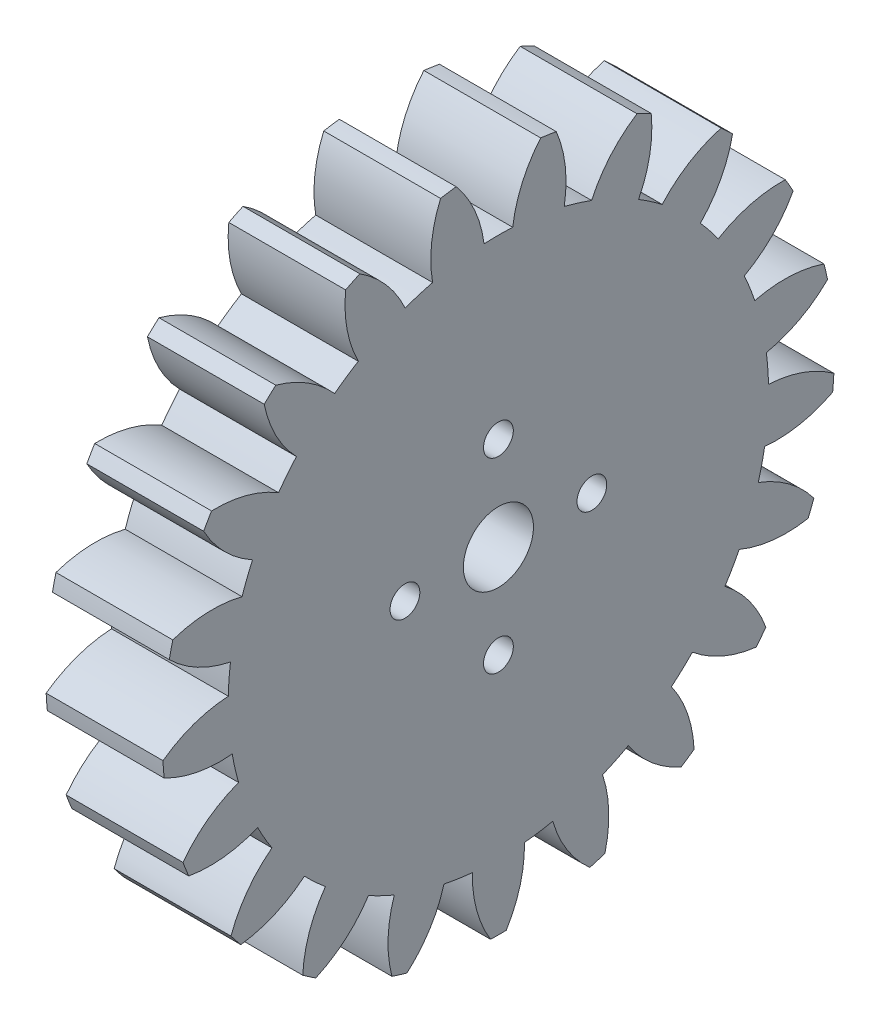
from build123d import *

# Parameters (mm, degrees)
BASPROSKE_W              = 15
BASPROSKE_H              = 28.75
TOOTHCUT_DEPTH           = 44.337339558
TEETHCUTS_COUNT          = 21
TEETHCUTS_ANGLE          = 342.857142857
HUBNEAONESKE_R           = 12
HUBNEARONE_DEPTH         = 35.0000508
BORSKE_R                 = 3
BORE_DEPTH               = 15.0000508
CUT_EXTRUDE_1_DEPTH      = 54.627906094
CUT_EXTRUDE_1_DEPTH_BACK = 54.627906094
SKETCH_2_R               = 1.275
CUT_EXTRUDE_2_DEPTH      = 44.312224095
CUT_EXTRUDE_3_DEPTH      = 5


with BuildPart() as part:
    # BasProSke → Base-Revolve (revolve)
    with BuildSketch(Plane(origin=(0, 0, 0), x_dir=(1, 0, 0), z_dir=(0, 1, 0)), mode=Mode.PRIVATE) as base_revolve_sk:
        with Locations((7.5, 14.375)):
            Rectangle(BASPROSKE_W, BASPROSKE_H)
    revolve(base_revolve_sk.sketch.rotate(Axis((-10, 0, 0), (1, 0, 0)), 180), axis=Axis((-10, 0, 0), (1, 0, 0)))

    # TooCutSke → ToothCut (cut, through all)
    with BuildSketch(Plane(origin=(0, 0, 0), x_dir=(0, 0, -1), z_dir=(1, 0, 0))):
        with BuildLine():
            ThreePointArc((1.226021101, 23.091475662), (0, 23.124), (-1.226021101, 23.091475662))
            ThreePointArc((-1.226021101, 23.091475662), (-2.035978165, 25.992768242), (-3.636318743, 28.544716344))
            ThreePointArc((-3.636318743, 28.544716344), (0, 28.7754), (3.636318743, 28.544716344))
            ThreePointArc((3.636318743, 28.544716344), (2.035978165, 25.992768242), (1.226021101, 23.091475662))
        make_face()
    toothcut = extrude(amount=TOOTHCUT_DEPTH, mode=Mode.SUBTRACT)

    # TeethCuts: ToothCut ×21 about axis
    teethcuts_axis = Axis((-10, 0, 0), (1, 0, 0))
    for i in range(1, TEETHCUTS_COUNT):
        add(toothcut.rotate(teethcuts_axis, i * TEETHCUTS_ANGLE / (TEETHCUTS_COUNT - 1)), mode=Mode.SUBTRACT)

    # HubNeaOneSke → HubNearOne (add)
    with BuildSketch(Plane.ZY):
        with Locations(Location((0, 0, 0), (0, 0, 180))):
            Circle(HUBNEAONESKE_R)
    extrude(amount=HUBNEARONE_DEPTH)

    # BorSke → Bore (cut, symmetric)
    with BuildSketch(Plane(origin=(0, 0, 0), x_dir=(0, 0, -1), z_dir=(1, 0, 0))):
        with Locations(Location((0, 0, 0), (0, 0, 180))):
            Circle(BORSKE_R)
    extrude(amount=BORE_DEPTH, both=True, mode=Mode.SUBTRACT)

    # 草圖1 → 除料-伸長1 (cut, two sides: drawn at the far end of the back side and taken through both)
    with BuildSketch(Plane(origin=(0, 0, 0), x_dir=(1, 0, 0), z_dir=(0, 1, 0)).offset(-CUT_EXTRUDE_1_DEPTH_BACK)):
        Polygon((-35.0000508, -11.862952099), (-35.0000508, -15.448809423), (0, -15.448809423), (0, -11.862952099), (0, 12), (-35.0000508, 12), align=None)
    extrude(amount=CUT_EXTRUDE_1_DEPTH + CUT_EXTRUDE_1_DEPTH_BACK, mode=Mode.SUBTRACT)

    # 草圖2 → 除料-伸長2 (cut, through all)
    with BuildSketch(Plane.ZY):
        with Locations((0, 8)):
            Circle(SKETCH_2_R)
        with Locations((8, 0)):
            Circle(SKETCH_2_R)
        with Locations((0, -8)):
            Circle(SKETCH_2_R)
        with Locations((-8, 0)):
            Circle(SKETCH_2_R)
    extrude(amount=-CUT_EXTRUDE_2_DEPTH, mode=Mode.SUBTRACT)

    # 草圖3 → 除料-伸長3 (cut)
    with BuildSketch(Plane.ZY):
        with BuildLine():
            ThreePointArc((15.633632839, -24.127826762), (16.195451669, -23.754364762), (16.748353108, -23.367823351))
            ThreePointArc((16.748353108, -23.367823351), (16.182150595, -20.424548747), (14.807455158, -17.761155586))
            ThreePointArc((14.807455158, -17.761155586), (15.728314388, -16.951091484), (16.604929283, -16.093343329))
            ThreePointArc((16.604929283, -16.093343329), (19.158143938, -17.66323046), (22.050876182, -18.447800942))
            ThreePointArc((22.050876182, -18.447800942), (22.477655121, -17.925331803), (22.892057619, -17.392992783))
            ThreePointArc((22.892057619, -17.392992783), (21.483464476, -14.747370732), (19.384793984, -12.60750325))
            ThreePointArc((19.384793984, -12.60750325), (20.025971437, -11.562), (20.610815085, -10.483972412))
            ThreePointArc((20.610815085, -10.483972412), (23.513329931, -11.231540632), (26.508802408, -11.128607052))
            ThreePointArc((26.508802408, -11.128607052), (26.762620274, -10.503554451), (27.001702351, -9.872718478))
            ThreePointArc((27.001702351, -9.872718478), (24.87587826, -7.75982411), (22.239708796, -6.333618923))
            ThreePointArc((22.239708796, -6.333618923), (22.544233041, -5.145574077), (22.785339517, -3.943054539))
            ThreePointArc((22.785339517, -3.943054539), (25.779253374, -3.80187913), (28.611305207, -2.820587588))
            ThreePointArc((28.611305207, -2.820587588), (28.669609169, -2.148490191), (28.712127333, -1.475209811))
            ThreePointArc((28.712127333, -1.475209811), (26.057961094, -0.082783062), (23.118527885, 0.50303524))
            ThreePointArc((23.118527885, 0.50303524), (23.059340606, 1.728058684), (22.935286541, 2.948221034))
            ThreePointArc((22.935286541, 2.948221034), (25.754577023, 3.965596017), (28.17156798, 5.738053461))
            ThreePointArc((28.17156798, 5.738053461), (28.029177475, 6.397476851), (27.871353801, 7.053377721))
            ThreePointArc((27.871353801, 7.053377721), (24.924679732, 7.601613624), (21.943164316, 7.294992515))
            ThreePointArc((21.943164316, 7.294992515), (21.525524564, 8.448145847), (21.047332707, 9.57753423))
            ThreePointArc((21.047332707, 9.57753423), (23.441493482, 11.380710555), (25.22866331, 13.786843279))
            ThreePointArc((25.22866331, 13.786843279), (24.898230359, 14.375), (24.554088173, 14.95524169))
            ThreePointArc((24.554088173, 14.95524169), (21.576731195, 14.610573581), (18.818054303, 13.438757691))
            ThreePointArc((18.818054303, 13.438757691), (18.079071201, 14.417578178), (17.289230996, 15.35584148))
            ThreePointArc((17.289230996, 15.35584148), (19.045530374, 17.784599017), (20.04408119, 20.610611569))
            ThreePointArc((20.04408119, 20.610611569), (19.554966211, 21.075241315), (19.055084056, 21.528266805))
            ThreePointArc((19.055084056, 21.528266805), (16.311595404, 20.321319958), (14.020877582, 18.388430271))
            ThreePointArc((14.020877582, 18.388430271), (13.026213023, 19.105945417), (11.994905239, 19.769714826))
            ThreePointArc((11.994905239, 19.769714826), (12.957288312, 22.608247809), (13.078494494, 25.603036573))
            ThreePointArc((13.078494494, 25.603036573), (12.4741575, 25.902854952), (11.862952099, 26.188410939))
            ThreePointArc((11.862952099, 26.188410939), (9.597102778, 24.226427877), (7.977884359, 21.704210125))
            ThreePointArc((7.977884359, 21.704210125), (6.815918653, 22.096665561), (5.634779513, 22.426962252))
            ThreePointArc((5.634779513, 22.426962252), (5.717734322, 25.42305457), (4.950826169, 28.320519421))
            ThreePointArc((4.950826169, 28.320519421), (4.284965153, 28.428886254), (3.616744788, 28.521599835))
            ThreePointArc((3.616744788, 28.521599835), (2.029865455, 25.978911364), (1.226021101, 23.091475662))
            ThreePointArc((1.226021101, 23.091475662), (0, 23.124), (-1.226021101, 23.091475662))
            ThreePointArc((-1.226021101, 23.091475662), (-2.029865455, 25.978911364), (-3.616744788, 28.521599835))
            ThreePointArc((-3.616744788, 28.521599835), (-4.284965153, 28.428886254), (-4.950826169, 28.320519421))
            ThreePointArc((-4.950826169, 28.320519421), (-5.717734322, 25.42305457), (-5.634779513, 22.426962252))
            ThreePointArc((-5.634779513, 22.426962252), (-6.815918653, 22.096665561), (-7.977884359, 21.704210125))
            ThreePointArc((-7.977884359, 21.704210125), (-9.597102778, 24.226427877), (-11.862952099, 26.188410939))
            ThreePointArc((-11.862952099, 26.188410939), (-12.4741575, 25.902854952), (-13.078494494, 25.603036573))
            ThreePointArc((-13.078494494, 25.603036573), (-12.957288312, 22.608247809), (-11.994905239, 19.769714826))
            ThreePointArc((-11.994905239, 19.769714826), (-13.026213023, 19.105945417), (-14.020877582, 18.388430271))
            ThreePointArc((-14.020877582, 18.388430271), (-16.311595404, 20.321319958), (-19.055084056, 21.528266805))
            ThreePointArc((-19.055084056, 21.528266805), (-19.554966211, 21.075241315), (-20.04408119, 20.610611569))
            ThreePointArc((-20.04408119, 20.610611569), (-19.045530374, 17.784599017), (-17.289230996, 15.35584148))
            ThreePointArc((-17.289230996, 15.35584148), (-18.079071201, 14.417578178), (-18.818054303, 13.438757691))
            ThreePointArc((-18.818054303, 13.438757691), (-21.576731195, 14.610573581), (-24.554088173, 14.95524169))
            ThreePointArc((-24.554088173, 14.95524169), (-24.898230359, 14.375), (-25.22866331, 13.786843279))
            ThreePointArc((-25.22866331, 13.786843279), (-23.441493482, 11.380710555), (-21.047332707, 9.57753423))
            ThreePointArc((-21.047332707, 9.57753423), (-21.525524564, 8.448145847), (-21.943164316, 7.294992515))
            ThreePointArc((-21.943164316, 7.294992515), (-24.924679732, 7.601613624), (-27.871353801, 7.053377721))
            ThreePointArc((-27.871353801, 7.053377721), (-28.029177475, 6.397476851), (-28.17156798, 5.738053461))
            ThreePointArc((-28.17156798, 5.738053461), (-25.754577023, 3.965596017), (-22.935286541, 2.948221034))
            ThreePointArc((-22.935286541, 2.948221034), (-23.059340606, 1.728058684), (-23.118527885, 0.50303524))
            ThreePointArc((-23.118527885, 0.50303524), (-26.057961094, -0.082783062), (-28.712127333, -1.475209811))
            ThreePointArc((-28.712127333, -1.475209811), (-28.669609169, -2.148490191), (-28.611305207, -2.820587588))
            ThreePointArc((-28.611305207, -2.820587588), (-25.779253374, -3.80187913), (-22.785339517, -3.943054539))
            ThreePointArc((-22.785339517, -3.943054539), (-22.544233041, -5.145574077), (-22.239708796, -6.333618923))
            ThreePointArc((-22.239708796, -6.333618923), (-24.87587826, -7.75982411), (-27.001702351, -9.872718478))
            ThreePointArc((-27.001702351, -9.872718478), (-26.762620274, -10.503554451), (-26.508802408, -11.128607052))
            ThreePointArc((-26.508802408, -11.128607052), (-23.513329931, -11.231540632), (-20.610815085, -10.483972412))
            ThreePointArc((-20.610815085, -10.483972412), (-20.025971437, -11.562), (-19.384793984, -12.60750325))
            ThreePointArc((-19.384793984, -12.60750325), (-21.483464476, -14.747370732), (-22.892057619, -17.392992783))
            ThreePointArc((-22.892057619, -17.392992783), (-22.477655121, -17.925331803), (-22.050876182, -18.447800942))
            ThreePointArc((-22.050876182, -18.447800942), (-19.158143938, -17.66323046), (-16.604929283, -16.093343329))
            ThreePointArc((-16.604929283, -16.093343329), (-15.728314388, -16.951091484), (-14.807455158, -17.761155586))
            ThreePointArc((-14.807455158, -17.761155586), (-16.182150595, -20.424548747), (-16.748353108, -23.367823351))
            ThreePointArc((-16.748353108, -23.367823351), (-16.195451669, -23.754364762), (-15.633632839, -24.127826762))
            ThreePointArc((-15.633632839, -24.127826762), (-13.100672782, -22.525464747), (-11.123622645, -20.272750066))
            ThreePointArc((-11.123622645, -20.272750066), (-10.033127583, -20.834004101), (-8.914408959, -21.336651305))
            ThreePointArc((-8.914408959, -21.336651305), (-9.44298162, -24.286915974), (-9.116483925, -27.266320266))
            ThreePointArc((-9.116483925, -27.266320266), (-8.474211264, -27.472718166), (-7.827272612, -27.663989291))
            ThreePointArc((-7.827272612, -27.663989291), (-5.879149357, -25.386212641), (-4.65393332, -22.650833995))
            ThreePointArc((-4.65393332, -22.650833995), (-3.446453363, -22.865724026), (-2.229278404, -23.016291921))
            ThreePointArc((-2.229278404, -23.016291921), (-1.864762288, -25.991284136), (-0.674575137, -28.742084969))
            ThreePointArc((-0.674575137, -28.742084969), (0, -28.75), (0.674575137, -28.742084969))
            ThreePointArc((0.674575137, -28.742084969), (1.864762288, -25.991284136), (2.229278404, -23.016291921))
            ThreePointArc((2.229278404, -23.016291921), (3.446453363, -22.865724026), (4.65393332, -22.650833995))
            ThreePointArc((4.65393332, -22.650833995), (5.879149357, -25.386212641), (7.827272612, -27.663989291))
            ThreePointArc((7.827272612, -27.663989291), (8.474211264, -27.472718166), (9.116483925, -27.266320266))
            ThreePointArc((9.116483925, -27.266320266), (9.44298162, -24.286915974), (8.914408959, -21.336651305))
            ThreePointArc((8.914408959, -21.336651305), (10.033127583, -20.834004101), (11.123622645, -20.272750066))
            ThreePointArc((11.123622645, -20.272750066), (13.100672782, -22.525464747), (15.633632839, -24.127826762))
        make_face()
    extrude(amount=-CUT_EXTRUDE_3_DEPTH, mode=Mode.SUBTRACT)


solid = part.part
